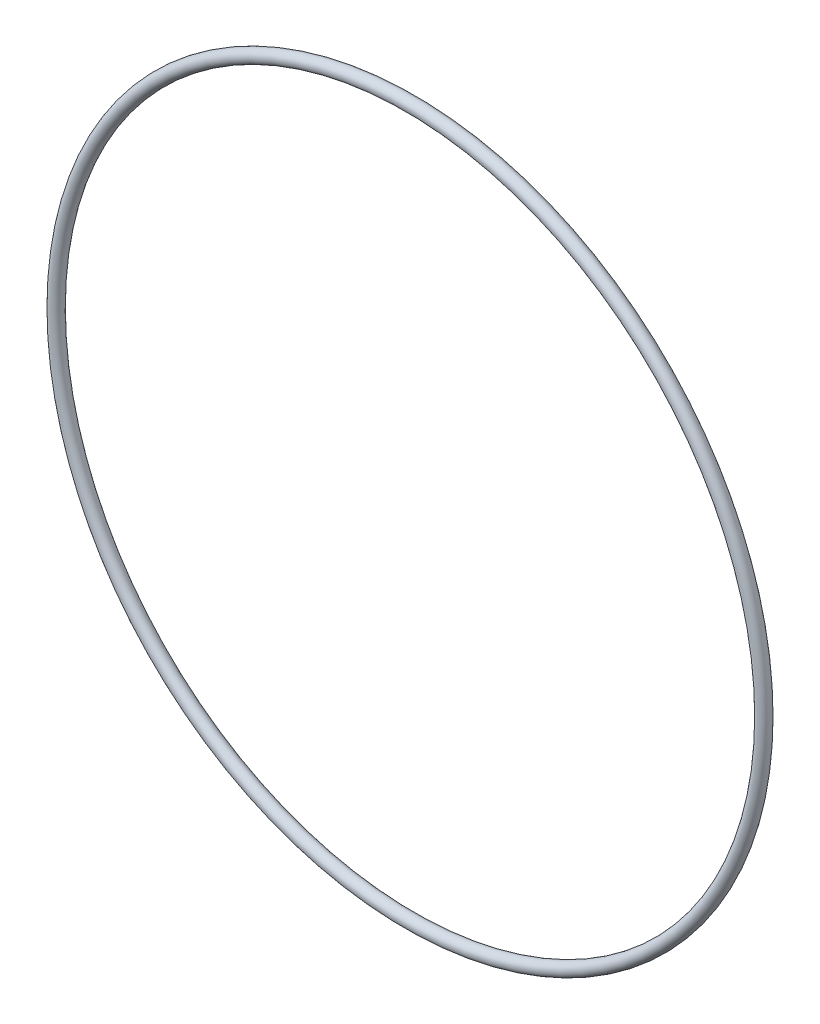
from build123d import *

# Parameters (mm, degrees)
SKETCH2_R = 0.889


with BuildPart() as part:
    # Sketch2 → Revolve1 (revolve)
    with BuildSketch(Plane(origin=(0, 0, 0), x_dir=(1, 0, 0), z_dir=(0, 1, 0))):
        with Locations((-48.3743, 0)):
            Circle(SKETCH2_R)
    revolve(axis=Axis((0, 0, 0.889), (0, 0, -1)))


solid = part.part
